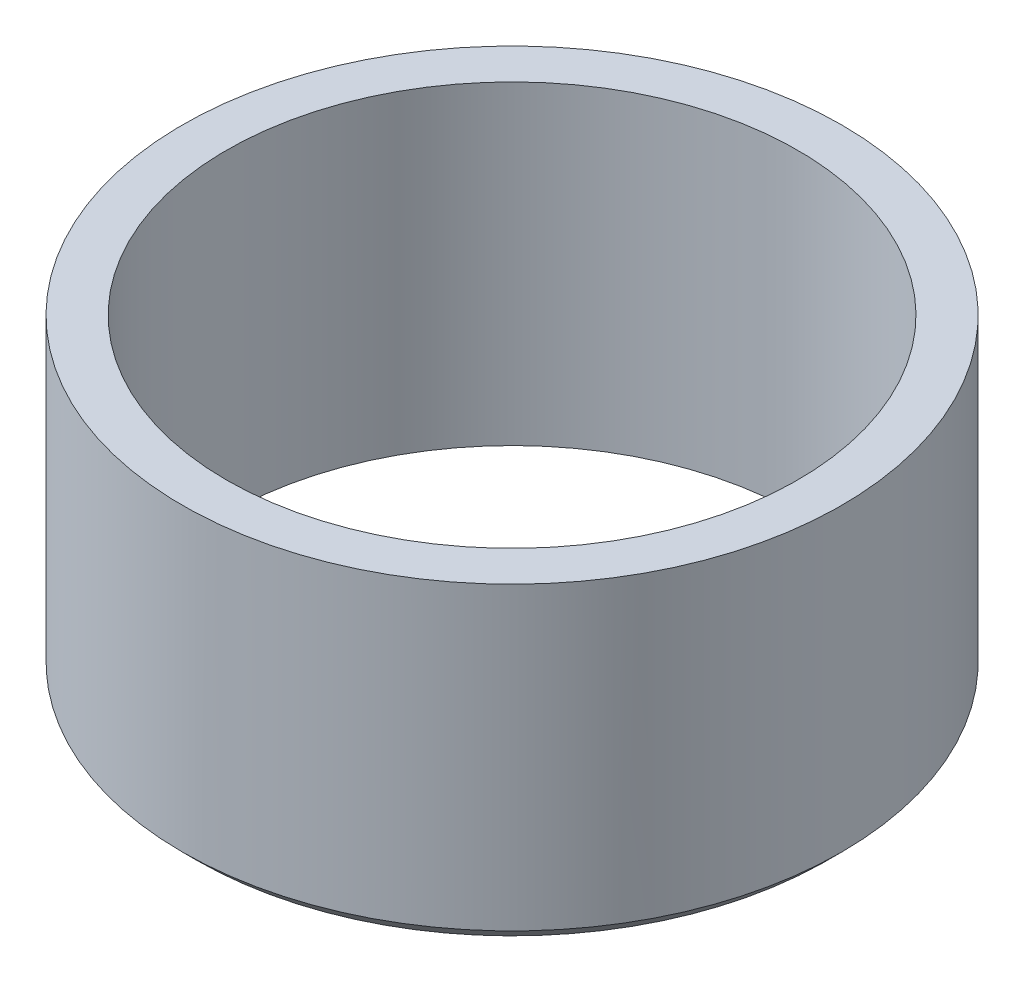
from build123d import *

# Parameters (mm, degrees)
SKETCH1_R           = 4.5
BOSS_EXTRUDE1_DEPTH = 4.3
SKETCH2_R           = 3.9
CUT_EXTRUDE1_DEPTH  = 8.680494776
CHAMFER1_SIZE       = 0.2


with BuildPart() as part:
    # Sketch1 → Boss-Extrude1 (new body)
    with BuildSketch(Plane(origin=(0, 0, 0), x_dir=(1, 0, 0), z_dir=(0, 1, 0))):
        with Locations(Location((0, 0, 0), (0, 0, 90))):
            Circle(SKETCH1_R)
    extrude(amount=BOSS_EXTRUDE1_DEPTH)

    # Sketch2 → Cut-Extrude1 (cut, through all)
    with BuildSketch(Plane(origin=(0, 4.3, 0), x_dir=(1, 0, 0), z_dir=(0, 1, 0))):
        with Locations(Location((0, 0, 0), (0, 0, 270))):
            Circle(SKETCH2_R)
    extrude(amount=-CUT_EXTRUDE1_DEPTH, mode=Mode.SUBTRACT)

    # Chamfer1
    chamfer1_edges = [part.edges().sort_by_distance(p)[0] for p in [
        (0, 0, 4.5),
    ]]
    chamfer(chamfer1_edges, length=CHAMFER1_SIZE)


solid = part.part
